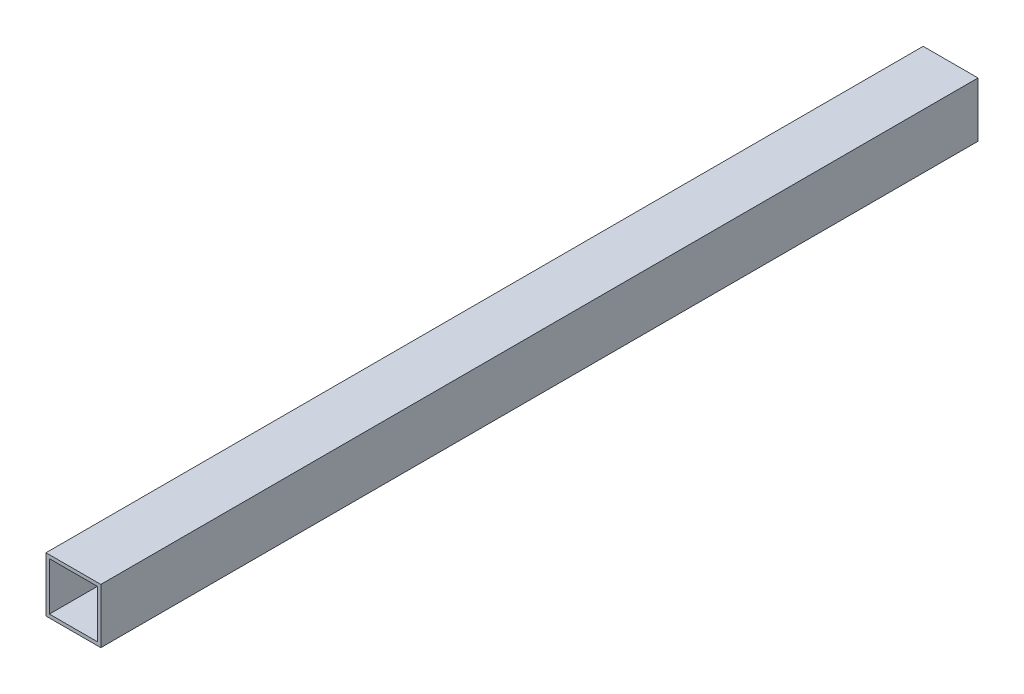
from build123d import *

# Parameters (mm, degrees)
SKETCH1_W           = 50.8
SKETCH1_H           = 50.8
SKETCH1_W_2         = 44.45
SKETCH1_H_2         = 44.45
BOSS_EXTRUDE1_DEPTH = 812.8


with BuildPart() as part:
    # Sketch1 → Boss-Extrude1 (new body)
    with BuildSketch(Plane.XY):
        Rectangle(SKETCH1_W, SKETCH1_H)
        Rectangle(SKETCH1_W_2, SKETCH1_H_2, mode=Mode.SUBTRACT)
    extrude(amount=BOSS_EXTRUDE1_DEPTH)


solid = part.part
